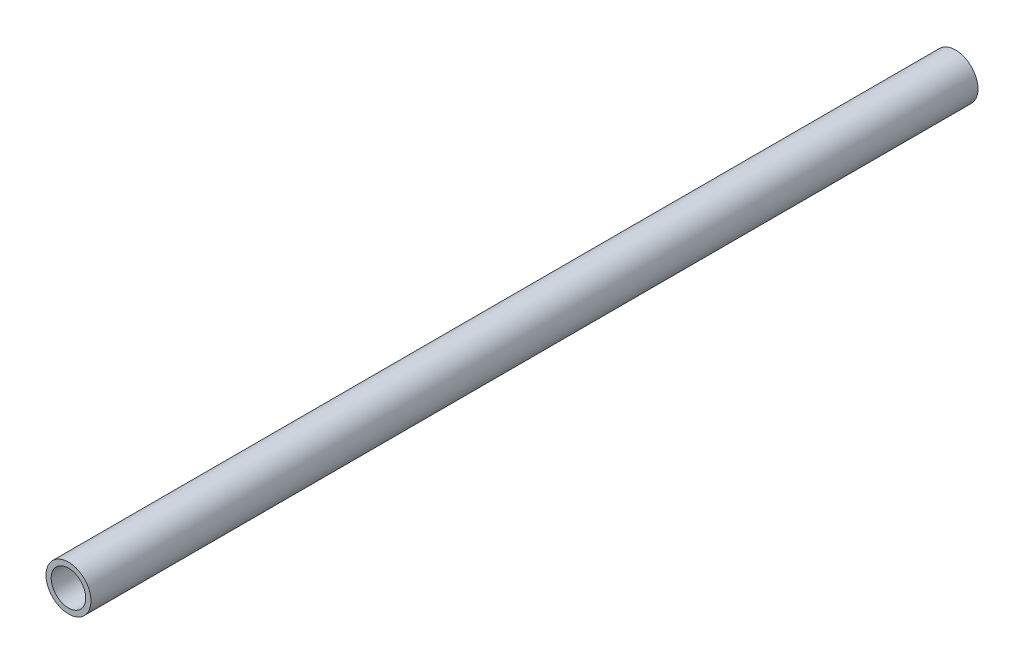
from build123d import *

# Parameters (mm, degrees)
SKETCH1_R           = 6.35
SKETCH1_R_2         = 4.8768
BOSS_EXTRUDE1_DEPTH = 250.48972


with BuildPart() as part:
    # Sketch1 → Boss-Extrude1 (new body)
    with BuildSketch(Plane.XY):
        with Locations(Location((0, 0, 0), (0, 0, 191.03852135))):
            Circle(SKETCH1_R)
        with Locations(Location((0, 0, 0), (0, 0, 191.03852135))):
            Circle(SKETCH1_R_2, mode=Mode.SUBTRACT)
    extrude(amount=BOSS_EXTRUDE1_DEPTH)


solid = part.part
